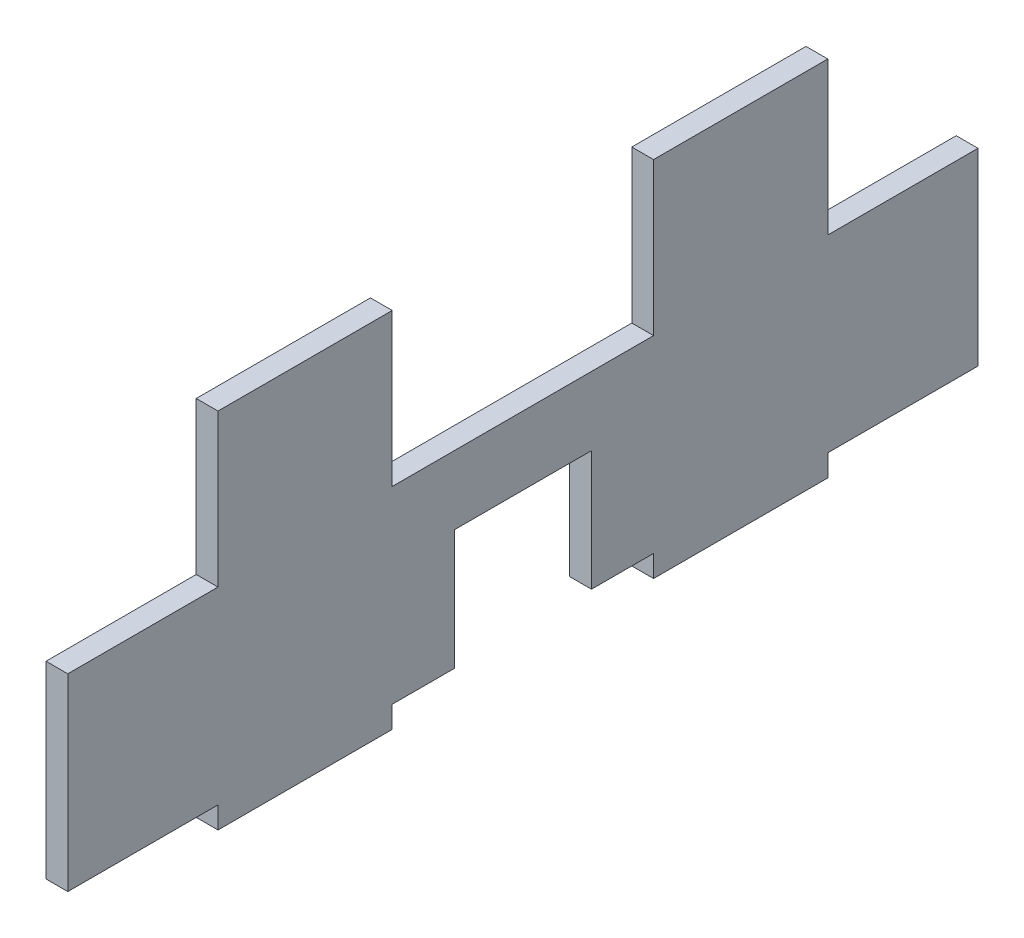
from build123d import *

# Parameters (mm, degrees)
BOSS_EXTRUDE1_DEPTH = 6.35
SKETCH4_W           = 6.35
SKETCH4_H           = 237.700000096
SKETCH4_H_2         = 112.7
BOSS_EXTRUDE2_DEPTH = 6.35
SKETCH5_W           = 6.35
SKETCH5_H           = 390.400000096
BOSS_EXTRUDE3_DEPTH = 6.35
SKETCH6_W           = 125.000000096
SKETCH6_H           = 67.700000012
CUT_EXTRUDE1_DEPTH  = 265.978178443
SKETCH7_W           = 76.2
SKETCH7_H           = 6.35
CUT_EXTRUDE2_DEPTH  = 147.333301068
SKETCH8_W           = 6.35
SKETCH8_H           = 50.8
BOSS_EXTRUDE4_DEPTH = 38.1


with BuildPart() as part:
    # Sketch3 → Boss-Extrude1 (new body)
    with BuildSketch(Plane(origin=(0, 0, 0), x_dir=(0, 0, -1), z_dir=(1, 0, 0))):
        Polygon((-132.7, 55.000000012), (-132.7, 0), (-20, 0), (-20, 35), (20, 35), (20, 0), (257.700000096, 0), (257.700000096, 55.000000012), align=None)
    extrude(amount=BOSS_EXTRUDE1_DEPTH)

    # Sketch4 → Boss-Extrude2 (add)
    with BuildSketch(Plane.XZ):
        with Locations((3.175, -138.850000048)):
            Rectangle(SKETCH4_W, SKETCH4_H)
        with Locations((3.175, 76.35)):
            Rectangle(SKETCH4_W, SKETCH4_H_2)
    extrude(amount=BOSS_EXTRUDE2_DEPTH)

    # Sketch5 → Boss-Extrude3 (add)
    with BuildSketch(Plane(origin=(0, 55.000000012, 0), x_dir=(1, 0, 0), z_dir=(0, 1, 0))):
        with Locations((3.175, 62.500000048)):
            Rectangle(SKETCH5_W, SKETCH5_H)
    extrude(amount=BOSS_EXTRUDE3_DEPTH)

    # Sketch6 → Cut-Extrude1 (cut, through all)
    with BuildSketch(Plane(origin=(6.35, 0, 0), x_dir=(0, 0, -1), z_dir=(1, 0, 0))):
        with Locations((195.200000048, 27.500000006)):
            Rectangle(SKETCH6_W, SKETCH6_H)
    extrude(amount=-CUT_EXTRUDE1_DEPTH, mode=Mode.SUBTRACT)

    # Sketch7 → Cut-Extrude2 (cut, through all)
    with BuildSketch(Plane(origin=(6.35, 0, 0), x_dir=(0, 0, -1), z_dir=(1, 0, 0))):
        Polygon((-88.9, 0), (-126.35, 0), (-132.7, 0), (-132.7, -6.35), (-88.9, -6.35), align=None)
        Polygon((-26.35, 0), (-38.1, 0), (-38.1, -6.35), (-20, -6.35), (-20, 0), align=None)
        Polygon((26.35, 0), (20, 0), (20, -6.35), (38.1, -6.35), (38.1, 0), align=None)
        Polygon((132.7, 0), (126.35, 0), (88.9, 0), (88.9, -6.35), (132.7, -6.35), align=None)
        Polygon((88.9, 61.350000012), (88.9, 55.000000012), (126.35, 55.000000012), (132.7, 55.000000012), (132.7, 61.350000012), align=None)
        with Locations((0, 58.175000012)):
            Rectangle(SKETCH7_W, SKETCH7_H)
        Polygon((-132.7, 55.000000012), (-126.35, 55.000000012), (-88.9, 55.000000012), (-88.9, 61.350000012), (-132.7, 61.350000012), align=None)
    extrude(amount=-CUT_EXTRUDE2_DEPTH, mode=Mode.SUBTRACT)

    # Sketch8 → Boss-Extrude4 (add)
    with BuildSketch(Plane(origin=(0, 61.350000012, 0), x_dir=(1, 0, 0), z_dir=(0, 1, 0))):
        with Locations((3.175, 63.5)):
            Rectangle(SKETCH8_W, SKETCH8_H)
        with Locations((3.175, -63.5)):
            Rectangle(SKETCH8_W, SKETCH8_H)
    extrude(amount=BOSS_EXTRUDE4_DEPTH)


solid = part.part
